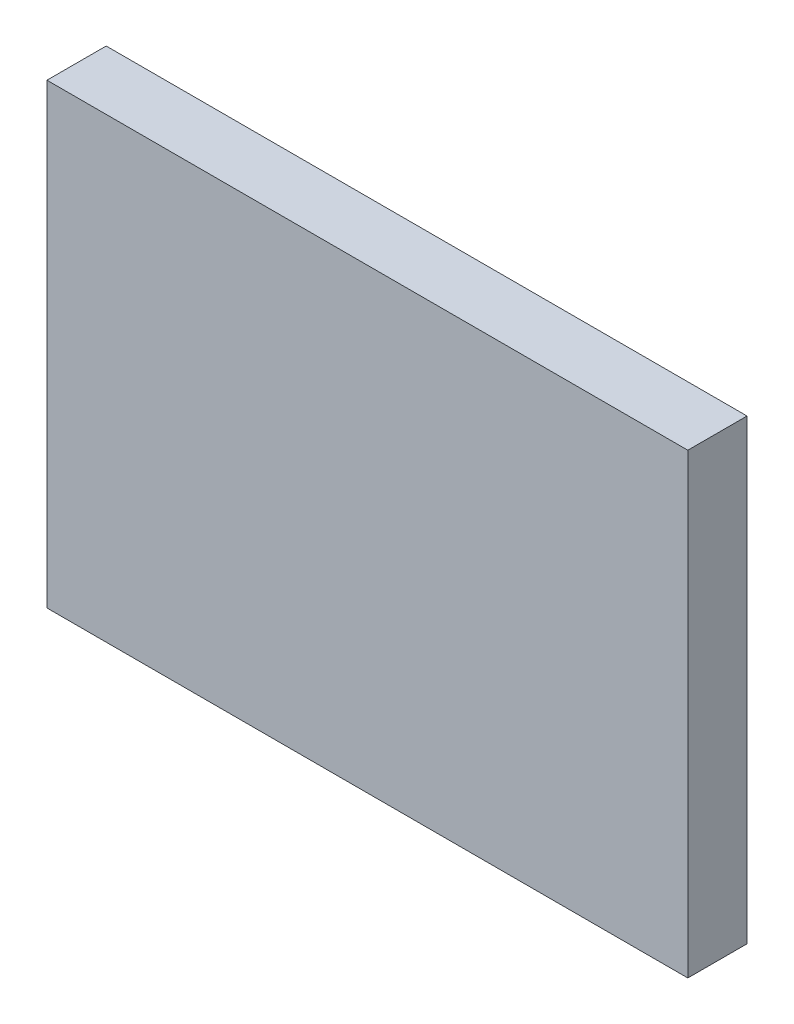
from build123d import *

# Parameters (mm, degrees)
SKETCH1_W           = 68.7
SKETCH1_H           = 49
BOSS_EXTRUDE1_DEPTH = 6.35


with BuildPart() as part:
    # Sketch1 → Boss-Extrude1 (new body)
    with BuildSketch(Plane.XY):
        with Locations((-34.35, 24.5)):
            Rectangle(SKETCH1_W, SKETCH1_H)
    extrude(amount=BOSS_EXTRUDE1_DEPTH)


solid = part.part
